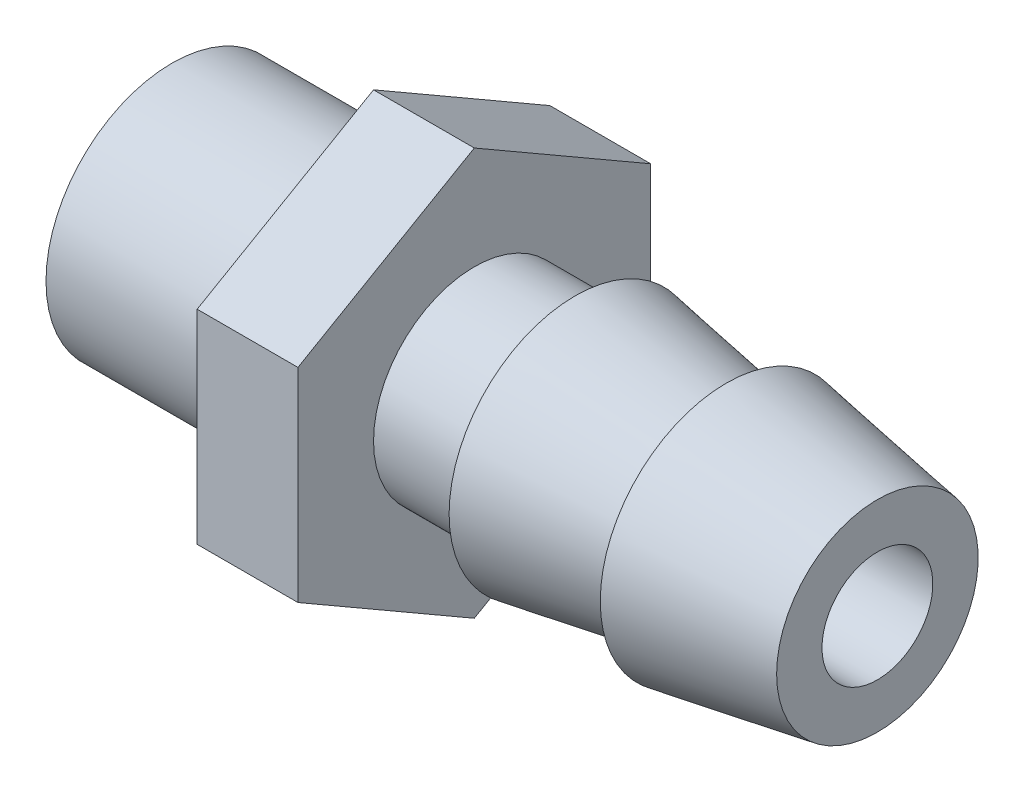
from build123d import *

# Parameters (mm, degrees)
ESQUISSE5_OUTSIDE_W     = 15.98
ESQUISSE5_OUTSIDE_H     = 15.98
ENL_V_MAT_EXTRU_1_DEPTH = 2


with BuildPart() as part:
    # Esquisse4 → Révolution2 (revolve)
    with BuildSketch(Plane.XY, mode=Mode.PRIVATE) as r_volution2_sk:
        Polygon((10, 1.1), (10, 2), (7, 2.5), (7, 2), (4, 2.5), (4, 2), (2, 2), (2, 5), (0, 5), (0, 2.5), (-4, 2.5), (-4, 1.1), align=None)
    revolve(r_volution2_sk.sketch.rotate(Axis((0, 0, 0), (1, 0, 0)), 90), axis=Axis((0, 0, 0), (1, 0, 0)))

    # Esquisse5 outside → Enlèv. mat.-Extru.1 (cut)
    with BuildSketch(Plane(origin=(2, 0, 0), x_dir=(0, 0, -1), z_dir=(1, 0, 0))):
        Rectangle(ESQUISSE5_OUTSIDE_W, ESQUISSE5_OUTSIDE_H)
        Polygon((0, -4.041451884), (3.5, -2.020725942), (3.5, 2.020725942), (0, 4.041451884), (-3.5, 2.020725942), (-3.5, -2.020725942), align=None, mode=Mode.SUBTRACT)
    extrude(amount=-ENL_V_MAT_EXTRU_1_DEPTH, mode=Mode.SUBTRACT)


solid = part.part
